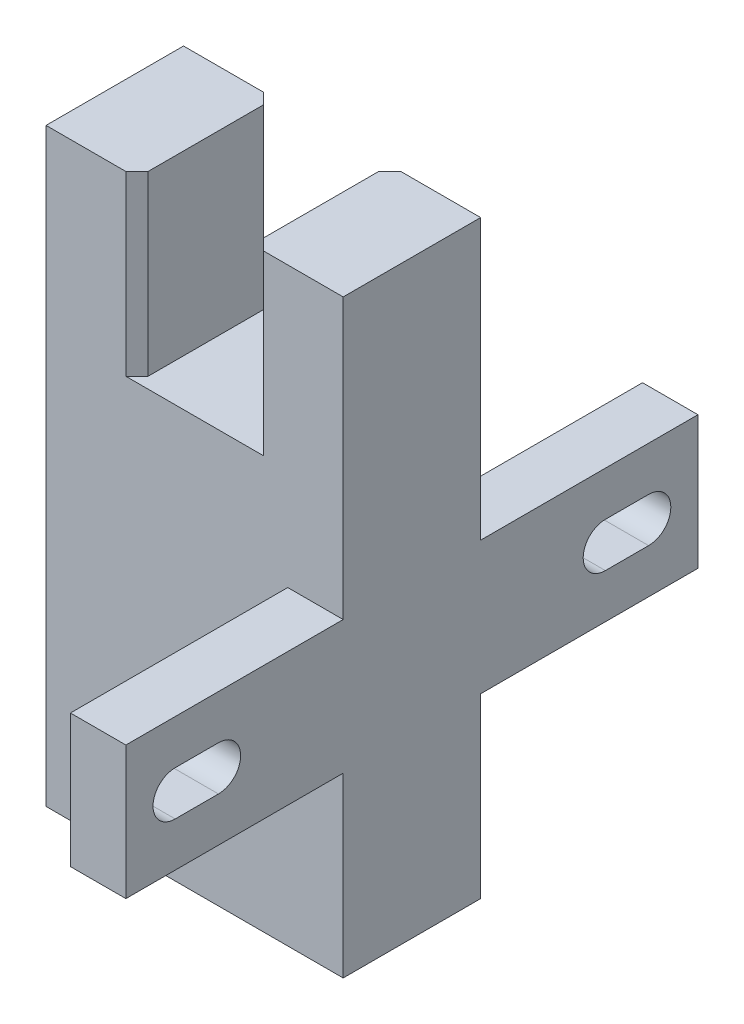
from build123d import *

# Parameters (mm, degrees)
EXTRUDE_1_DEPTH     = 6.2
SKETCH_2_W          = 2.5
SKETCH_2_H          = 6
EXTRUDE_2_DEPTH     = 9.8
SKETCH_3_W          = 2.5
SKETCH_3_H          = 6
EXTRUDE_3_DEPTH     = 9.8
CUT_EXTRUDE_1_DEPTH = 28.432848917
CHAMFER_1_SIZE      = 0.5


with BuildPart() as part:
    # 草图1 → 凸台-拉伸1 (new body)
    with BuildSketch(Plane.XY):
        Polygon((2.6, 0.795472494), (-2.6, 0.795472494), (-2.6, 8.795472494), (-6.7, 8.795472494), (-6.7, -17.804527506), (6.7, -17.804527506), (6.7, 8.795472494), (2.6, 8.795472494), align=None)
    extrude(amount=EXTRUDE_1_DEPTH)

    # 草图2 → 凸台-拉伸2 (add)
    with BuildSketch(Plane.XY.offset(6.2)):
        with Locations((5.45, -6.804527506)):
            Rectangle(SKETCH_2_W, SKETCH_2_H)
    extrude(amount=EXTRUDE_2_DEPTH)

    # 草图3 → 凸台-拉伸3 (add)
    with BuildSketch(Plane(origin=(0, 0, 0), x_dir=(-1, 0, 0), z_dir=(0, 0, -1))):
        with Locations((-5.45, -6.804527506)):
            Rectangle(SKETCH_3_W, SKETCH_3_H)
    extrude(amount=EXTRUDE_3_DEPTH)

    # 草图5 → 切除-拉伸1 (cut, through all)
    with BuildSketch(Plane(origin=(6.7, 0, 0), x_dir=(0, 0, -1), z_dir=(1, 0, 0))):
        with BuildLine():
            Line((-13.775713177, -5.804527506), (-11.824286823, -5.804527506))
            ThreePointArc((-11.824286823, -5.804527506), (-10.824286823, -6.804527506), (-11.824286823, -7.804527506))
            Line((-11.824286823, -7.804527506), (-13.775713177, -7.804527506))
            ThreePointArc((-13.775713177, -7.804527506), (-14.775713177, -6.804527506), (-13.775713177, -5.804527506))
        make_face()
        with BuildLine():
            Line((7.575713177, -5.804527506), (5.624286823, -5.804527506))
            ThreePointArc((5.624286823, -5.804527506), (4.624286823, -6.804527506), (5.624286823, -7.804527506))
            Line((5.624286823, -7.804527506), (7.575713177, -7.804527506))
            ThreePointArc((7.575713177, -7.804527506), (8.575713177, -6.804527506), (7.575713177, -5.804527506))
        make_face()
    extrude(amount=-CUT_EXTRUDE_1_DEPTH, mode=Mode.SUBTRACT)

    # 倒角1
    chamfer_1_edges = [part.edges().sort_by_distance(p)[0] for p in [
        (-2.6, 4.795472494, 0),
        (2.6, 4.795472494, 0),
        (-2.6, 4.795472494, 6.2),
        (2.6, 4.795472494, 6.2),
    ]]
    chamfer(chamfer_1_edges, length=CHAMFER_1_SIZE)


solid = part.part
